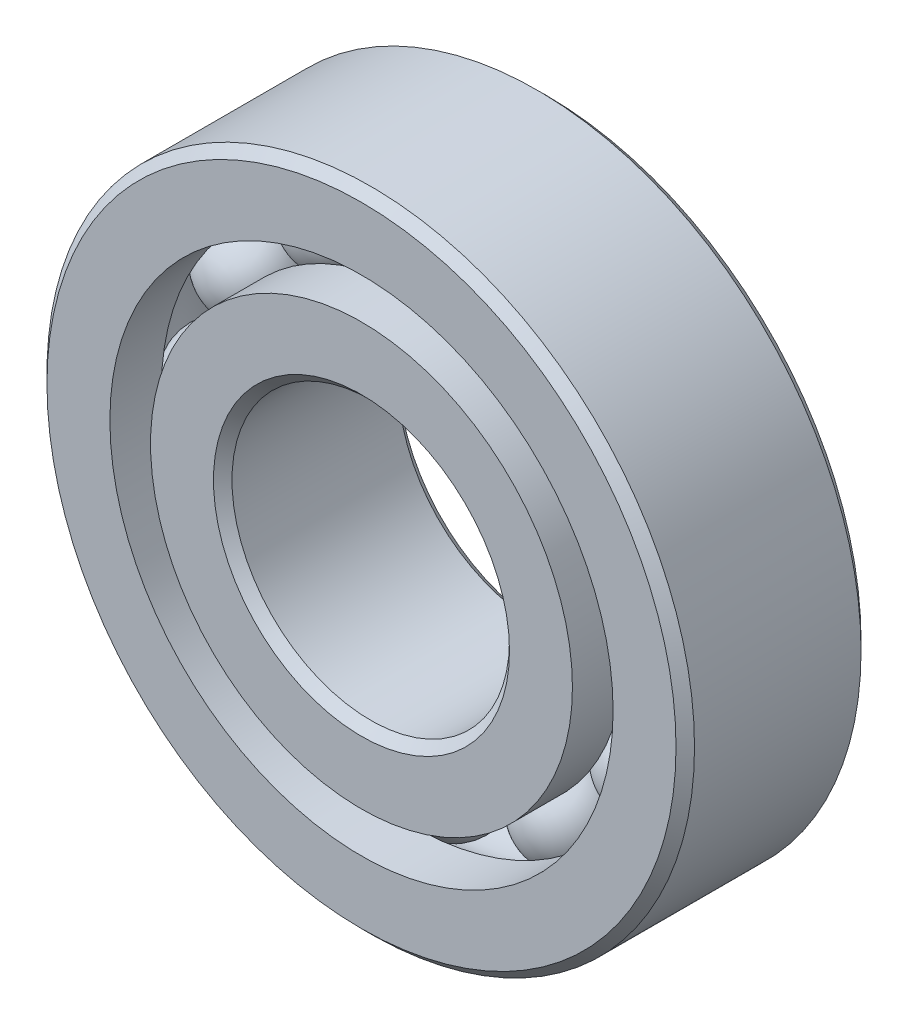
from build123d import *

# Parameters (mm, degrees)
CIRPATTERN1_COUNT = 12


with BuildPart() as part:
    # Sketch1 → Revolve1 (revolve)
    with BuildSketch(Plane(origin=(0, 0, 0), x_dir=(0, 0, -1), z_dir=(1, 0, 0)), mode=Mode.PRIVATE) as revolve1_sk:
        with BuildLine():
            Line((3.6, 14), (-3.6, 14))
            Line((-3.6, 14), (-4, 13.6))
            Line((-4, 13.6), (-4, 10.879120879))
            Line((-4, 10.879120879), (-1.777777778, 10.879120879))
            ThreePointArc((-1.777777778, 10.879120879), (0, 11.983266837), (1.777777778, 10.879120879))
            Line((1.777777778, 10.879120879), (4, 10.879120879))
            Line((4, 10.879120879), (4, 13.6))
            Line((4, 13.6), (3.6, 14))
        make_face()
    revolve(revolve1_sk.sketch.rotate(Axis((0, 0, 4), (0, 0, -1)), 90), axis=Axis((0, 0, 4), (0, 0, -1)))


with BuildPart() as body_2:
    # Sketch3 → Revolve3 (revolve)
    with BuildSketch(Plane(origin=(0, 0, 0), x_dir=(0, 0, -1), z_dir=(1, 0, 0)), mode=Mode.PRIVATE) as revolve3_sk:
        with BuildLine():
            Line((-4, 9.120879121), (-1.777777778, 9.120879121))
            ThreePointArc((-1.777777778, 9.120879121), (0, 8.016733163), (1.777777778, 9.120879121))
            Line((1.777777778, 9.120879121), (4, 9.120879121))
            Line((4, 9.120879121), (4, 6.4))
            Line((4, 6.4), (3.6, 6))
            Line((3.6, 6), (-3.6, 6))
            Line((-3.6, 6), (-4, 6.4))
            Line((-4, 6.4), (-4, 9.120879121))
        make_face()
    revolve(revolve3_sk.sketch.rotate(Axis((0, 0, 4), (0, 0, -1)), 90), axis=Axis((0, 0, 4), (0, 0, -1)))


with BuildPart() as body_3:
    # Sketch4 → Revolve4 (revolve)
    with BuildSketch(Plane(origin=(0, 0, 0), x_dir=(0, 0, -1), z_dir=(1, 0, 0))):
        with BuildLine():
            Line((-1.983266837, 10), (1.983266837, 10))
            ThreePointArc((1.983266837, 10), (0, 11.983266837), (-1.983266837, 10))
        make_face()
    revolve(axis=Axis((0, 10, 1.983266837), (0, 0, -1)))


with BuildPart() as cirpattern1_1:
    # CirPattern1: pattern copy
    add(body_3.part.rotate(Axis((0, 0, 0), (0, 0, 1)), 1 * 360 / CIRPATTERN1_COUNT))


with BuildPart() as cirpattern1_2:
    # CirPattern1: pattern copy
    add(body_3.part.rotate(Axis((0, 0, 0), (0, 0, 1)), 2 * 360 / CIRPATTERN1_COUNT))


with BuildPart() as cirpattern1_3:
    # CirPattern1: pattern copy
    add(body_3.part.rotate(Axis((0, 0, 0), (0, 0, 1)), 3 * 360 / CIRPATTERN1_COUNT))


with BuildPart() as cirpattern1_4:
    # CirPattern1: pattern copy
    add(body_3.part.rotate(Axis((0, 0, 0), (0, 0, 1)), 4 * 360 / CIRPATTERN1_COUNT))


with BuildPart() as cirpattern1_5:
    # CirPattern1: pattern copy
    add(body_3.part.rotate(Axis((0, 0, 0), (0, 0, 1)), 5 * 360 / CIRPATTERN1_COUNT))


with BuildPart() as cirpattern1_6:
    # CirPattern1: pattern copy
    add(body_3.part.rotate(Axis((0, 0, 0), (0, 0, 1)), 6 * 360 / CIRPATTERN1_COUNT))


with BuildPart() as cirpattern1_7:
    # CirPattern1: pattern copy
    add(body_3.part.rotate(Axis((0, 0, 0), (0, 0, 1)), 7 * 360 / CIRPATTERN1_COUNT))


with BuildPart() as cirpattern1_8:
    # CirPattern1: pattern copy
    add(body_3.part.rotate(Axis((0, 0, 0), (0, 0, 1)), 8 * 360 / CIRPATTERN1_COUNT))


with BuildPart() as cirpattern1_9:
    # CirPattern1: pattern copy
    add(body_3.part.rotate(Axis((0, 0, 0), (0, 0, 1)), 9 * 360 / CIRPATTERN1_COUNT))


with BuildPart() as cirpattern1_10:
    # CirPattern1: pattern copy
    add(body_3.part.rotate(Axis((0, 0, 0), (0, 0, 1)), 10 * 360 / CIRPATTERN1_COUNT))


with BuildPart() as cirpattern1_11:
    # CirPattern1: pattern copy
    add(body_3.part.rotate(Axis((0, 0, 0), (0, 0, 1)), 11 * 360 / CIRPATTERN1_COUNT))


solid = Compound([part.part, body_2.part, body_3.part, cirpattern1_1.part, cirpattern1_2.part, cirpattern1_3.part, cirpattern1_4.part, cirpattern1_5.part, cirpattern1_6.part, cirpattern1_7.part, cirpattern1_8.part, cirpattern1_9.part, cirpattern1_10.part, cirpattern1_11.part])
